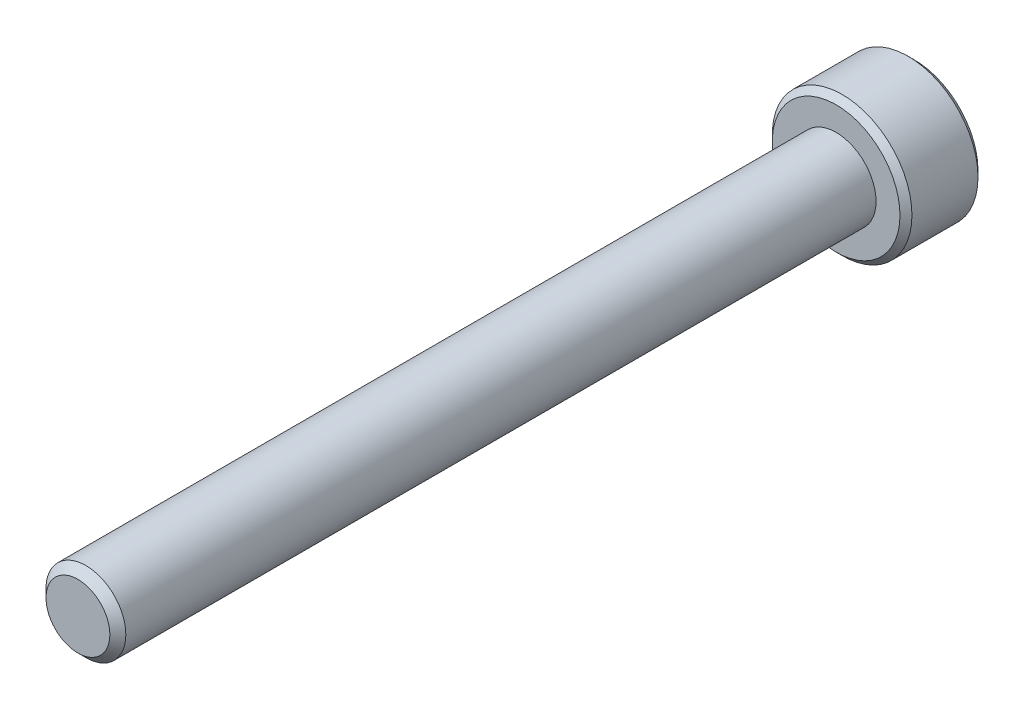
from build123d import *

# Parameters (mm, degrees)
SKETCH_1_R          = 3.5
EXTRUDE_1_DEPTH     = 3.91
SKETCH_2_R          = 2
EXTRUDE_2_DEPTH     = 38
CUT_EXTRUDE_1_DEPTH = 2
CHAMFER_1_SIZE      = 0.4
CHAMFER_2_SIZE      = 0.3


with BuildPart() as part:
    # 草图1 → 凸台-拉伸1 (new body)
    with BuildSketch(Plane.XY):
        Circle(SKETCH_1_R)
    extrude(amount=EXTRUDE_1_DEPTH)

    # 草图2 → 凸台-拉伸2 (add)
    with BuildSketch(Plane.XY.offset(3.91)):
        Circle(SKETCH_2_R)
    extrude(amount=EXTRUDE_2_DEPTH)

    # 草图3 → 切除-拉伸1 (cut)
    with BuildSketch(Plane(origin=(0, 0, 0), x_dir=(-1, 0, 0), z_dir=(0, 0, -1))):
        Polygon((0, 1.760918321), (-1.525, 0.880459161), (-1.525, -0.880459161), (0, -1.760918321), (1.525, -0.880459161), (1.525, 0.880459161), align=None)
    extrude(amount=-CUT_EXTRUDE_1_DEPTH, mode=Mode.SUBTRACT)

    # 倒角1
    chamfer_1_edges = [part.edges().sort_by_distance(p)[0] for p in [
        (-2, 0, 41.91),
    ]]
    chamfer(chamfer_1_edges, length=CHAMFER_1_SIZE)

    # 倒角2
    chamfer_2_edges = [part.edges().sort_by_distance(p)[0] for p in [
        (-3.5, 0, 0),
        (-3.5, 0, 3.91),
    ]]
    chamfer(chamfer_2_edges, length=CHAMFER_2_SIZE)


solid = part.part
